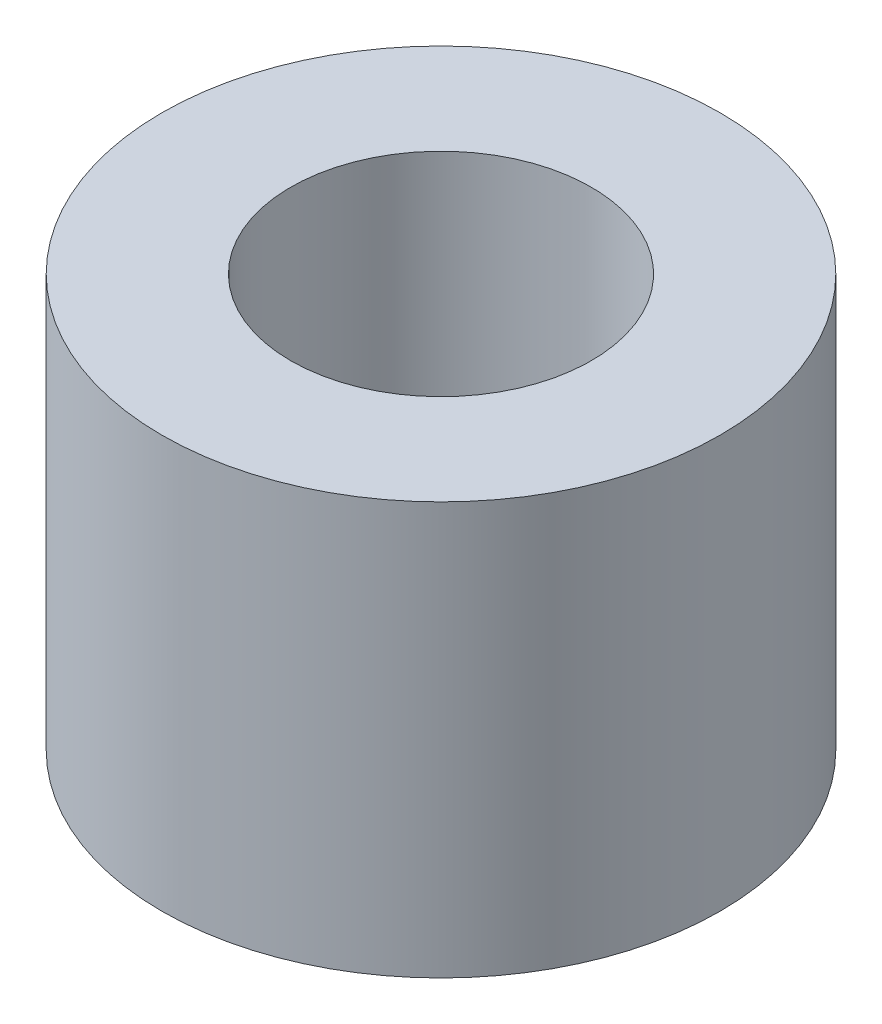
from build123d import *

# Parameters (mm, degrees)
SKETCH1_R           = 3.25
SKETCH1_R_2         = 1.75
BOSS_EXTRUDE1_DEPTH = 4.8


with BuildPart() as part:
    # Sketch1 → Boss-Extrude1 (new body)
    with BuildSketch(Plane(origin=(0, 0, 0), x_dir=(1, 0, 0), z_dir=(0, 1, 0))):
        with Locations(Location((0, 0, 0), (0, 0, 270))):
            Circle(SKETCH1_R)
        with Locations(Location((0, 0, 0), (0, 0, 270))):
            Circle(SKETCH1_R_2, mode=Mode.SUBTRACT)
    extrude(amount=BOSS_EXTRUDE1_DEPTH)


solid = part.part
